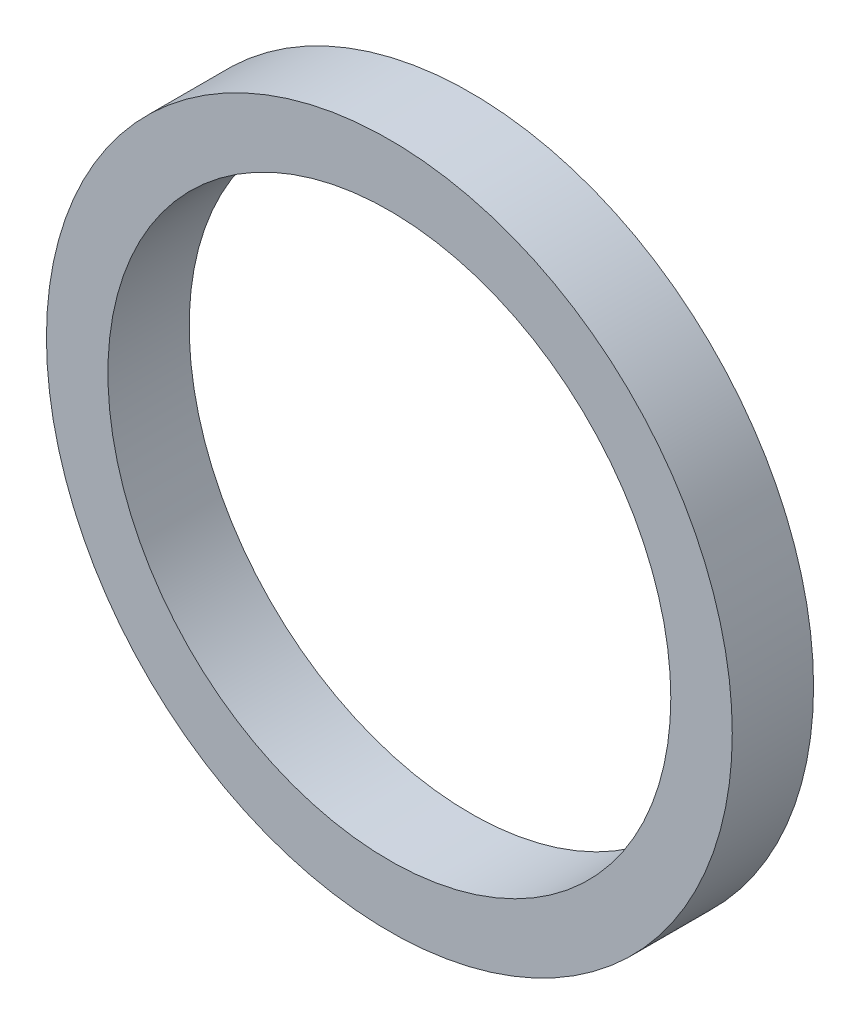
from build123d import *

# Parameters (mm, degrees)
SKETCH1_R           = 6.75
SKETCH1_R_2         = 5.54
BOSS_EXTRUDE1_DEPTH = 1.6


with BuildPart() as part:
    # Sketch1 → Boss-Extrude1 (new body)
    with BuildSketch(Plane.XY):
        Circle(SKETCH1_R)
        Circle(SKETCH1_R_2, mode=Mode.SUBTRACT)
    extrude(amount=BOSS_EXTRUDE1_DEPTH)


solid = part.part
